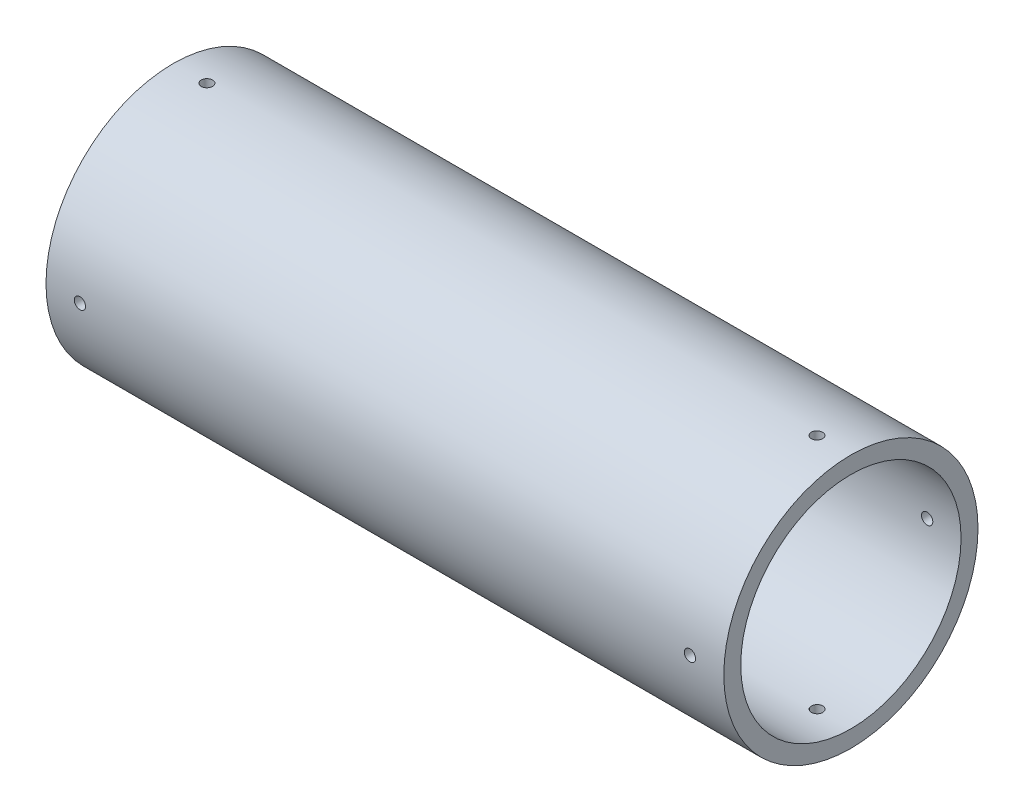
from build123d import *

# Parameters (mm, degrees)
SKETCH_1_R               = 22.5
SKETCH_1_R_2             = 19.5
EXTRUDE_1_DEPTH          = 120
SKETCH_3_R               = 1
CUT_EXTRUDE_1_DEPTH      = 10
PATTERN_CIRCULAR_1_COUNT = 4


with BuildPart() as part:
    # Эскиз1 → Бобышка-Вытянуть1 (new body)
    with BuildSketch(Plane(origin=(0, 0, 0), x_dir=(0, 0, -1), z_dir=(1, 0, 0))):
        Circle(SKETCH_1_R)
        Circle(SKETCH_1_R_2, mode=Mode.SUBTRACT)
    extrude(amount=EXTRUDE_1_DEPTH)

    # Эскиз3 → Вырез-Вытянуть1 (cut)
    with BuildSketch(Plane(origin=(0, 22.5, 0), x_dir=(1, 0, 0), z_dir=(0, 1, 0))):
        with Locations(Location((6, 0, 0), (0, 0, 270))):
            Circle(SKETCH_3_R)
        with Locations(Location((114, 0, 0), (0, 0, 270))):
            Circle(SKETCH_3_R)
    cut_extrude_1 = extrude(amount=-CUT_EXTRUDE_1_DEPTH, mode=Mode.SUBTRACT)

    # Круговой массив1: Вырез-Вытянуть1 ×4 about axis
    pattern_circular_1_axis = Axis((120, 0, 0), (-1, 0, 0))
    for i in range(1, PATTERN_CIRCULAR_1_COUNT):
        add(cut_extrude_1.rotate(pattern_circular_1_axis, i * 360 / PATTERN_CIRCULAR_1_COUNT), mode=Mode.SUBTRACT)


solid = part.part
